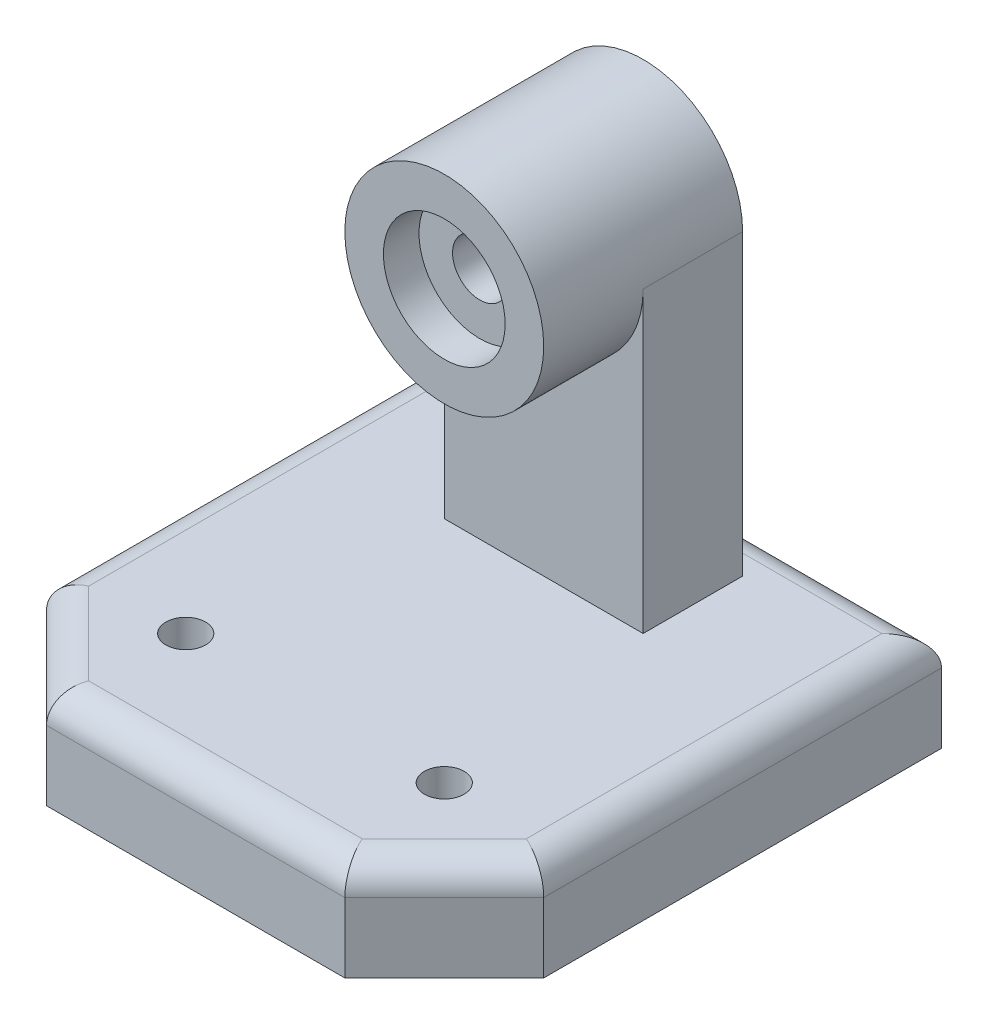
from build123d import *

# Parameters (mm, degrees)
SKETCH1_W                               = 50
SKETCH1_H                               = 50
BOSS_EXTRUDE1_DEPTH                     = 10
SKETCH2_W                               = 20
SKETCH2_H                               = 10
BOSS_EXTRUDE2_DEPTH                     = 30
SKETCH3_R                               = 10
BOSS_EXTRUDE3_DEPTH                     = 20
CBORE_FOR_M5_HEX_HEAD_BOLT1_D           = 5.5
CBORE_FOR_M5_HEX_HEAD_BOLT1_CBORE_D     = 12.24
CBORE_FOR_M5_HEX_HEAD_BOLT1_CBORE_DEPTH = 3.58
F_4_0MM_DOWEL_HOLE1_D                   = 4
CHAMFER1_SIZE                           = 10
FILLET1_R                               = 3


with BuildPart() as part:
    # Sketch1 → Boss-Extrude1 (new body)
    with BuildSketch(Plane(origin=(0, 0, 0), x_dir=(1, 0, 0), z_dir=(0, 1, 0))):
        with Locations((25, -25)):
            Rectangle(SKETCH1_W, SKETCH1_H)
    extrude(amount=BOSS_EXTRUDE1_DEPTH)

    # Sketch2 → Boss-Extrude2 (add)
    with BuildSketch(Plane(origin=(0, 10, 0), x_dir=(1, 0, 0), z_dir=(0, 1, 0))):
        with Locations((25, -10)):
            Rectangle(SKETCH2_W, SKETCH2_H)
    extrude(amount=BOSS_EXTRUDE2_DEPTH)

    # Sketch3 → Boss-Extrude3 (add)
    with BuildSketch(Plane(origin=(0, 0, 5), x_dir=(-1, 0, 0), z_dir=(0, 0, -1))):
        with Locations((-25, 40)):
            Circle(SKETCH3_R)
    extrude(amount=-BOSS_EXTRUDE3_DEPTH)

    # CBORE for M5 Hex Head Bolt1 (through all)
    with Locations(Plane.XY.offset(25)):
        with Locations((25, 40)):
            CounterBoreHole(CBORE_FOR_M5_HEX_HEAD_BOLT1_D / 2, CBORE_FOR_M5_HEX_HEAD_BOLT1_CBORE_D / 2, CBORE_FOR_M5_HEX_HEAD_BOLT1_CBORE_DEPTH)

    # Ø4.0mm Dowel Hole1 (through all)
    with Locations(Plane(origin=(0, 10, 0), x_dir=(1, 0, 0), z_dir=(0, 1, 0))):
        with Locations((12, -38), (38, -38)):
            Hole(F_4_0MM_DOWEL_HOLE1_D / 2)

    # Chamfer1
    chamfer1_edges = [part.edges().sort_by_distance(p)[0] for p in [
        (50, 5, 50),
        (0, 5, 50),
    ]]
    chamfer(chamfer1_edges, length=CHAMFER1_SIZE)

    # Fillet1
    fillet1_edges = [part.edges().sort_by_distance(p)[0] for p in [
        (25, 10, 0),
        (0, 10, 20),
        (50, 10, 20),
        (25, 10, 50),
        (5, 10, 45),
        (45, 10, 45),
    ]]
    fillet(fillet1_edges, radius=FILLET1_R)


solid = part.part
